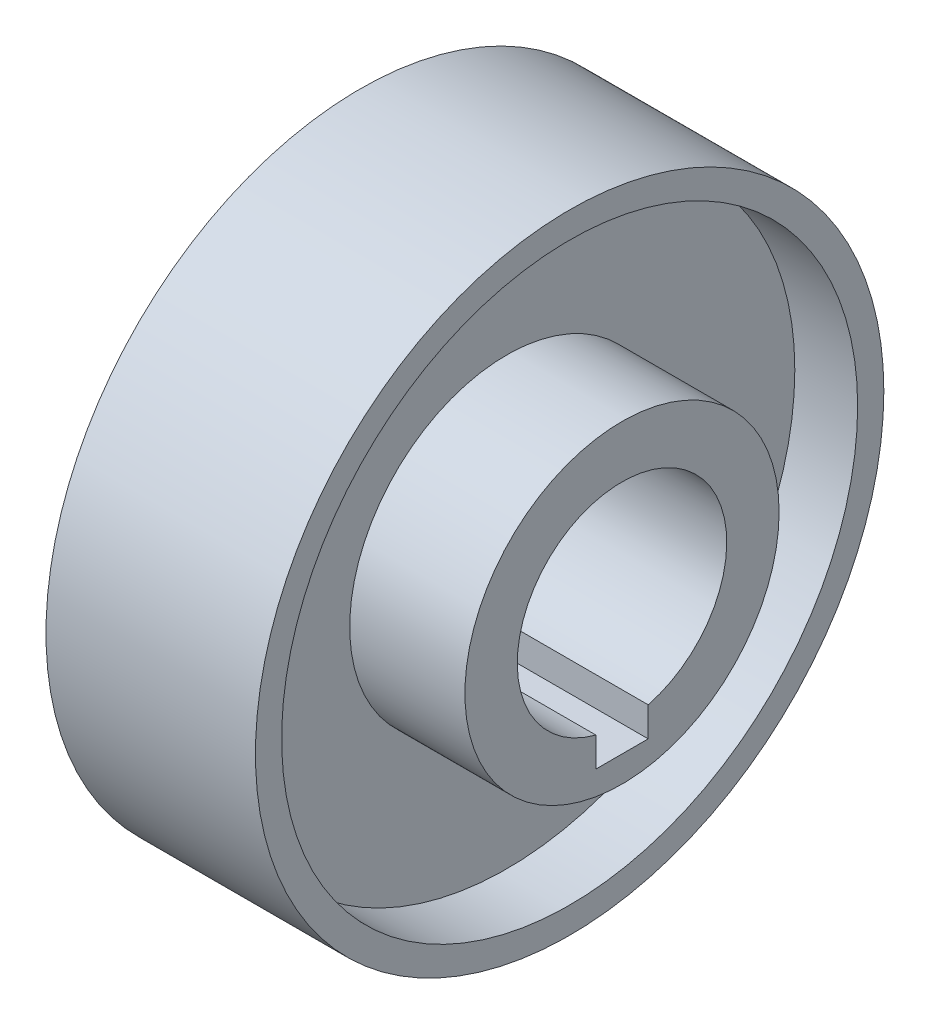
from build123d import *

# Parameters (mm, degrees)
IZIM1_R                     = 150
Y_KSEKLIK_EKSTR_ZYON1_DEPTH = 150
IZIM2_R                     = 300
IZIM2_R_2                   = 275
Y_KSEKLIK_EKSTR_ZYON2_DEPTH = 100
IZIM3_R                     = 275
IZIM3_R_2                   = 150
Y_KSEKLIK_EKSTR_ZYON3_DEPTH = 40


with BuildPart() as part:
    # Çizim1 → Yükseklik-Ekstrüzyon1 (new, symmetric)
    with BuildSketch(Plane(origin=(0, 0, 0), x_dir=(0, 0, -1), z_dir=(1, 0, 0))):
        Circle(IZIM1_R)
        with BuildLine():
            Line((-25, -125), (25, -125))
            Line((25, -125), (25, -96.824583655))
            ThreePointArc((25, -96.824583655), (0, 100), (-25, -96.824583655))
            Line((-25, -96.824583655), (-25, -125))
        make_face(mode=Mode.SUBTRACT)
    extrude(amount=Y_KSEKLIK_EKSTR_ZYON1_DEPTH, both=True)



with BuildPart() as body_2:
    # Çizim2 → Yükseklik-Ekstrüzyon2 (new, symmetric)
    with BuildSketch(Plane(origin=(0, 0, 0), x_dir=(0, 0, -1), z_dir=(1, 0, 0))):
        Circle(IZIM2_R)
        Circle(IZIM2_R_2, mode=Mode.SUBTRACT)
    extrude(amount=Y_KSEKLIK_EKSTR_ZYON2_DEPTH, both=True)


with BuildPart() as part_1:
    add(part.part)

    add(body_2.part)  # Yükseklik-Ekstrüzyon3 merges body 2
    # Çizim3 → Yükseklik-Ekstrüzyon3 (add, symmetric)
    with BuildSketch(Plane(origin=(0, 0, 0), x_dir=(0, 0, -1), z_dir=(1, 0, 0))):
        Circle(IZIM3_R)
        Circle(IZIM3_R_2, mode=Mode.SUBTRACT)
    extrude(amount=Y_KSEKLIK_EKSTR_ZYON3_DEPTH, both=True)


solid = part_1.part
